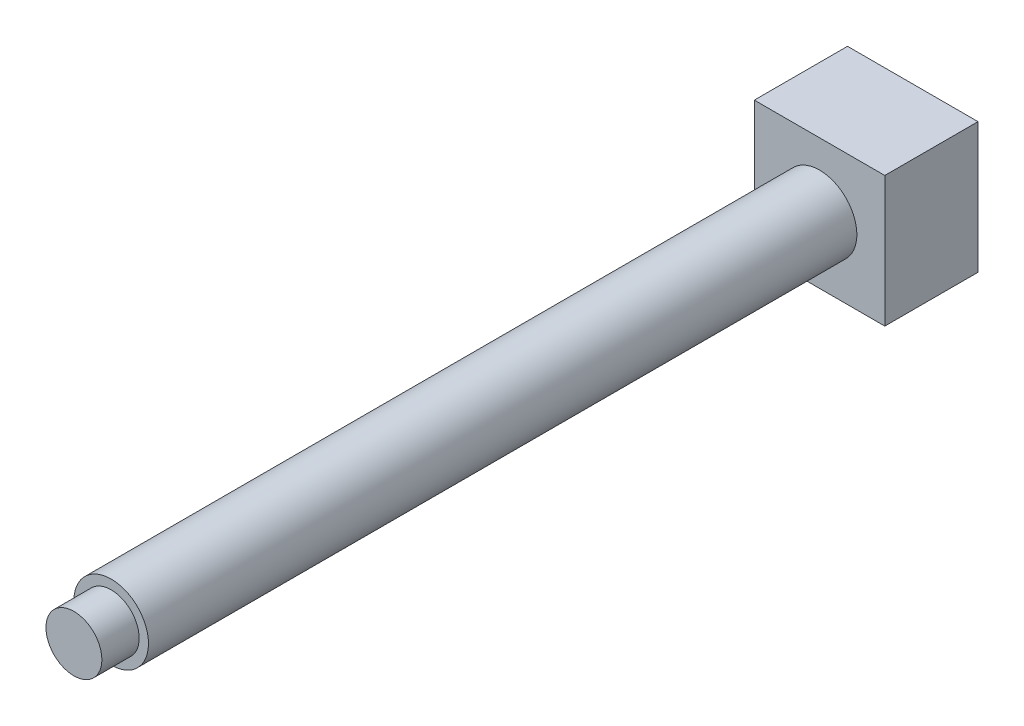
from build123d import *

# Parameters (mm, degrees)
SKETCH2_R           = 20
BOSS_EXTRUDE2_DEPTH = 380
SKETCH4_W           = 70
SKETCH4_H           = 70
BOSS_EXTRUDE3_DEPTH = 50
SKETCH5_R           = 15
BOSS_EXTRUDE4_DEPTH = 20


with BuildPart() as part:
    # Sketch2 → Boss-Extrude2 (new body)
    with BuildSketch(Plane.XY):
        Circle(SKETCH2_R)
    extrude(amount=BOSS_EXTRUDE2_DEPTH)

    # Sketch4 → Boss-Extrude3 (add)
    with BuildSketch(Plane(origin=(0, 0, 0), x_dir=(-1, 0, 0), z_dir=(0, 0, -1))):
        Rectangle(SKETCH4_W, SKETCH4_H)
    extrude(amount=BOSS_EXTRUDE3_DEPTH)

    # Sketch5 → Boss-Extrude4 (add)
    with BuildSketch(Plane.XY.offset(380)):
        Circle(SKETCH5_R)
    extrude(amount=BOSS_EXTRUDE4_DEPTH)


solid = part.part
